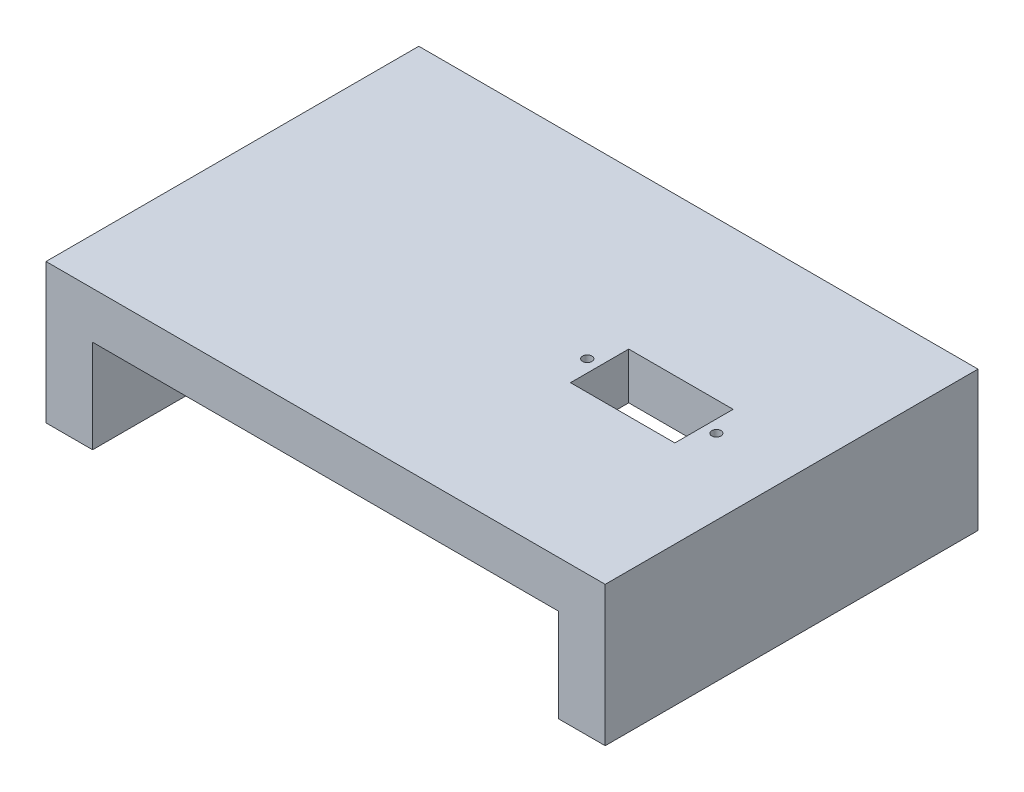
from build123d import *

# Parameters (mm, degrees)
SKETCH1_W           = 120
SKETCH1_H           = 80
BOSS_EXTRUDE1_DEPTH = 10
SKETCH2_W           = 22.4
SKETCH2_H           = 12.5
CUT_EXTRUDE1_DEPTH  = 10
SKETCH3_W           = 10
SKETCH3_H           = 80
BOSS_EXTRUDE2_DEPTH = 20
SKETCH4_R           = 1
CUT_EXTRUDE3_DEPTH  = 12


with BuildPart() as part:
    # Sketch1 → Boss-Extrude1 (new body)
    with BuildSketch(Plane(origin=(0, 0, 0), x_dir=(1, 0, 0), z_dir=(0, 1, 0))):
        Rectangle(SKETCH1_W, SKETCH1_H)
    extrude(amount=BOSS_EXTRUDE1_DEPTH)

    # Sketch2 → Cut-Extrude1 (cut)
    with BuildSketch(Plane(origin=(0, 10, 0), x_dir=(1, 0, 0), z_dir=(0, 1, 0))):
        with Locations((30, 0)):
            Rectangle(SKETCH2_W, SKETCH2_H)
    extrude(amount=-CUT_EXTRUDE1_DEPTH, mode=Mode.SUBTRACT)

    # Sketch3 → Boss-Extrude2 (add)
    with BuildSketch(Plane.XZ):
        with Locations((-55, 0)):
            Rectangle(SKETCH3_W, SKETCH3_H)
        with Locations((55, 0)):
            Rectangle(SKETCH3_W, SKETCH3_H)
    extrude(amount=BOSS_EXTRUDE2_DEPTH)

    # Sketch4 → Cut-Extrude3 (cut)
    with BuildSketch(Plane(origin=(0, 10, 0), x_dir=(1, 0, 0), z_dir=(0, 1, 0))):
        with Locations(Location((16.15, 0, 0), (0, 0, 270))):
            Circle(SKETCH4_R)
        with Locations(Location((43.85, 0, 0), (0, 0, 270))):
            Circle(SKETCH4_R)
    extrude(amount=-CUT_EXTRUDE3_DEPTH, mode=Mode.SUBTRACT)


solid = part.part
